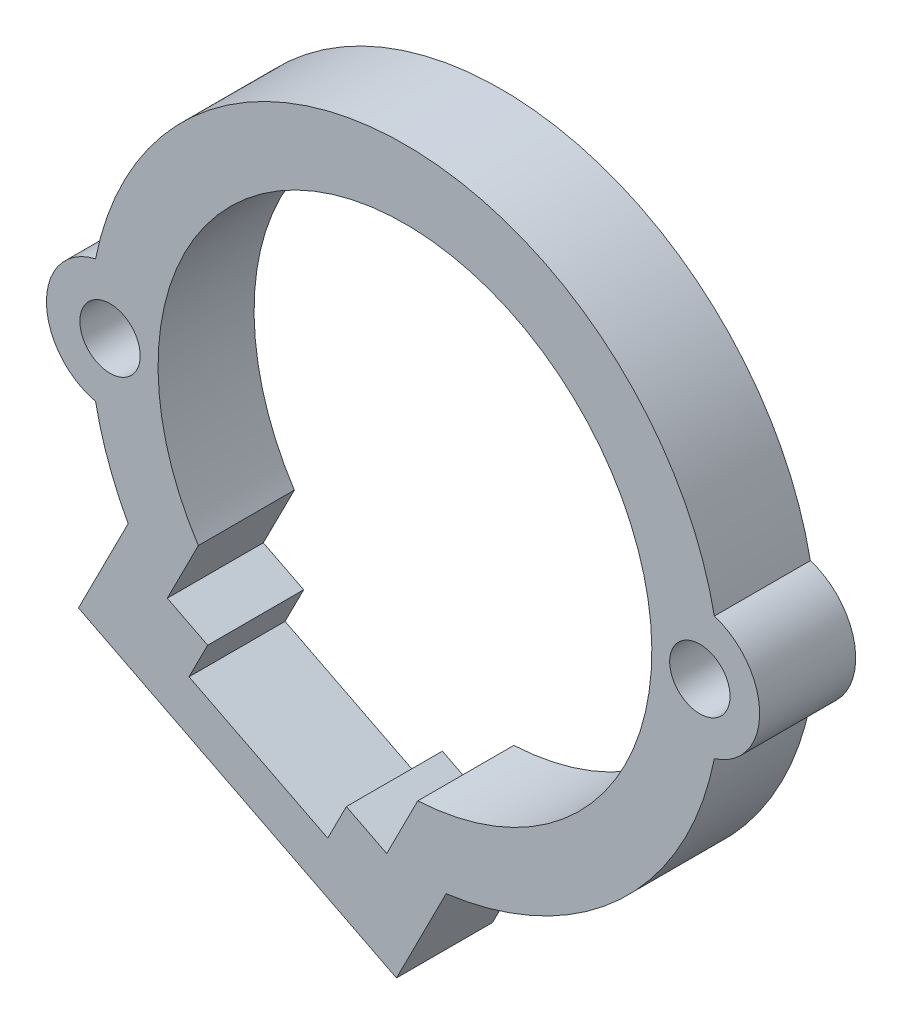
from build123d import *

# Parameters (mm, degrees)
SKETCH1_R           = 23
SKETCH1_R_2         = 18
BOSS_EXTRUDE1_DEPTH = 7
BOSS_EXTRUDE2_DEPTH = 7
CUT_EXTRUDE1_DEPTH  = 7
BOSS_EXTRUDE3_DEPTH = 7
SKETCH7_R           = 2.2
CUT_EXTRUDE2_DEPTH  = 7
CUT_EXTRUDE3_DEPTH  = 7


with BuildPart() as part:
    # Sketch1 → Boss-Extrude1 (new body)
    with BuildSketch(Plane.XY):
        Circle(SKETCH1_R)
        Circle(SKETCH1_R_2, mode=Mode.SUBTRACT)
    extrude(amount=BOSS_EXTRUDE1_DEPTH)

    # Sketch3 → Boss-Extrude2 (add)
    with BuildSketch(Plane.XY):
        with BuildLine():
            Line((-23.80139919, -18.167885182), (-0.617388595, -29.936557696))
            Line((-0.617388595, -29.936557696), (3.003741409, -22.803015975))
            ThreePointArc((3.003741409, -22.803015975), (-10.410748762, -20.508932449), (-20.180269185, -11.034343461))
            Line((-20.180269185, -11.034343461), (-23.80139919, -18.167885182))
        make_face()
    extrude(amount=BOSS_EXTRUDE2_DEPTH)

    # Sketch5 → Cut-Extrude1 (cut)
    with BuildSketch(Plane.XY):
        with BuildLine():
            Line((-15.062285021, -9.855332057), (-17.325491273, -14.313795633))
            Line((-17.325491273, -14.313795633), (-1.328523963, -22.434179668))
            Line((-1.328523963, -22.434179668), (0.93468229, -17.975716092))
            ThreePointArc((0.93468229, -17.975716092), (-8.14754251, -16.050468873), (-15.062285021, -9.855332057))
        make_face()
    extrude(amount=CUT_EXTRUDE1_DEPTH, mode=Mode.SUBTRACT)

    # Sketch6 → Boss-Extrude3 (add)
    with BuildSketch(Plane.XY):
        with BuildLine():
            ThreePointArc((-22.555487137, -4.5), (-26.136916399, 0), (-22.555487137, 4.5))
            ThreePointArc((-22.555487137, 4.5), (-23, 0), (-22.555487137, -4.5))
        make_face()
        with BuildLine():
            ThreePointArc((22.555487137, -4.5), (25.860234666, 0), (22.555487137, 4.5))
            ThreePointArc((22.555487137, 4.5), (23, 0), (22.555487137, -4.5))
        make_face()
    extrude(amount=BOSS_EXTRUDE3_DEPTH)

    # Sketch7 → Cut-Extrude2 (cut)
    with BuildSketch(Plane.XY):
        with Locations((-21.5, 0)):
            Circle(SKETCH7_R)
        with Locations((21.5, 0)):
            Circle(SKETCH7_R)
    extrude(amount=CUT_EXTRUDE2_DEPTH, mode=Mode.SUBTRACT)

    # Sketch8 → Cut-Extrude3 (cut)
    with BuildSketch(Plane.XY):
        Polygon((-14.382905313, -15.80751176), (-4.271109923, -20.940463541), (-5.629033675, -23.615541687), (-15.740829065, -18.482589905), align=None)
    extrude(amount=CUT_EXTRUDE3_DEPTH, mode=Mode.SUBTRACT)


solid = part.part
